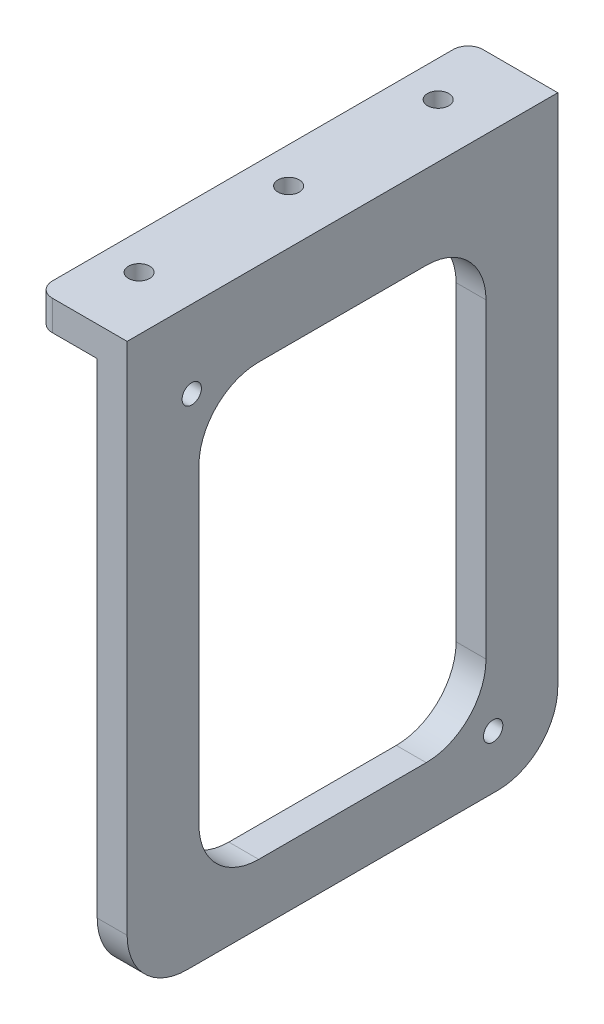
from build123d import *

# Parameters (mm, degrees)
SKETCH1_W                    = 45.72
SKETCH1_H                    = 60.96
BOSS_EXTRUDE1_DEPTH          = 9.525
SKETCH2_W                    = 45.72
SKETCH2_H                    = 57.785
CUT_EXTRUDE1_DEPTH           = 6.35
SKETCH3_W                    = 30.48
SKETCH3_H                    = 45.72
CUT_EXTRUDE2_DEPTH           = 40.272581084
FILLET1_R                    = 6.35
M2_5X0_45_TAPPED_HOLE1_D     = 2.05
M2_5X0_45_TAPPED_HOLE1_DEPTH = 7.366
M2_5X0_45_TAPPED_HOLE1_TIP   = 0.615882135
F_4_40_TAPPED_HOLE1_D        = 2.2606
FILLET2_R                    = 1.5875


with BuildPart() as part:
    # Sketch1 → Boss-Extrude1 (new body)
    with BuildSketch(Plane(origin=(0, 0, 0), x_dir=(0, 0, -1), z_dir=(1, 0, 0))):
        Rectangle(SKETCH1_W, SKETCH1_H)
    extrude(amount=BOSS_EXTRUDE1_DEPTH)

    # Sketch2 → Cut-Extrude1 (cut)
    with BuildSketch(Plane.ZY):
        with Locations((0, -1.5875)):
            Rectangle(SKETCH2_W, SKETCH2_H)
    extrude(amount=-CUT_EXTRUDE1_DEPTH, mode=Mode.SUBTRACT)

    # Sketch3 → Cut-Extrude2 (cut, through all)
    with BuildSketch(Plane(origin=(9.525, 0, 0), x_dir=(0, 0, -1), z_dir=(1, 0, 0))):
        with Locations((0, -1.27)):
            Rectangle(SKETCH3_W, SKETCH3_H)
    extrude(amount=-CUT_EXTRUDE2_DEPTH, mode=Mode.SUBTRACT)

    # Fillet1
    fillet1_edges = [part.edges().sort_by_distance(p)[0] for p in [
        (7.9375, 21.59, -15.24),
        (7.9375, -24.13, -15.24),
        (7.9375, -24.13, 15.24),
        (7.9375, 21.59, 15.24),
        (7.9375, -30.48, -22.86),
        (7.9375, -30.48, 22.86),
    ]]
    fillet(fillet1_edges, radius=FILLET1_R)

    # M2.5x0.45 Tapped Hole1
    with Locations(Plane.ZY.offset(-6.35)):
        with Locations((16, 22.23), (-16, -24.77), (0, -1.27)):
            Hole(M2_5X0_45_TAPPED_HOLE1_D / 2, depth=M2_5X0_45_TAPPED_HOLE1_DEPTH)
            with Locations((0, 0, -(M2_5X0_45_TAPPED_HOLE1_DEPTH + M2_5X0_45_TAPPED_HOLE1_TIP / 2))):  # 118° drill point
                Cone(0, M2_5X0_45_TAPPED_HOLE1_D / 2, M2_5X0_45_TAPPED_HOLE1_TIP, mode=Mode.SUBTRACT)

    # #4-40 Tapped Hole1 (through all)
    with Locations(Plane(origin=(0, 30.48, 0), x_dir=(-1, 0, 0), z_dir=(0, 1, 0))):
        with Locations((-3.81, -15.875), (-3.81, 15.875), (-3.81, 0)):
            Hole(F_4_40_TAPPED_HOLE1_D / 2)

    # Fillet2
    fillet2_edges = [part.edges().sort_by_distance(p)[0] for p in [
        (0, 28.8925, -22.86),
        (0, 28.8925, 22.86),
    ]]
    fillet(fillet2_edges, radius=FILLET2_R)


solid = part.part
